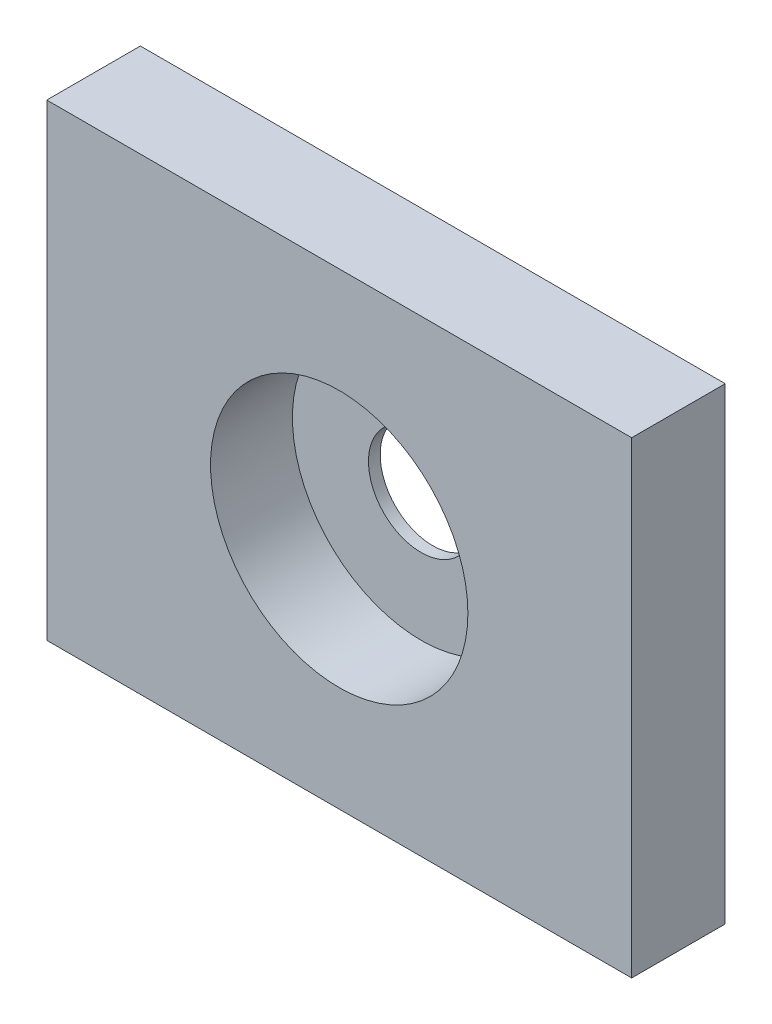
from build123d import *

# Parameters (mm, degrees)
ESQUISSE1_W             = 50
ESQUISSE1_H             = 40
ESQUISSE1_R             = 4.5
BOSS_EXTRU_1_DEPTH      = 8
ESQUISSE2_R             = 11
ENL_V_MAT_EXTRU_1_DEPTH = 7


with BuildPart() as part:
    # Esquisse1 → Boss.-Extru.1 (new body)
    with BuildSketch(Plane.XY):
        with Locations((25, 20)):
            Rectangle(ESQUISSE1_W, ESQUISSE1_H)
        with Locations((25, 20)):
            Circle(ESQUISSE1_R, mode=Mode.SUBTRACT)
    extrude(amount=BOSS_EXTRU_1_DEPTH)

    # Esquisse2 → Enlèv. mat.-Extru.1 (cut)
    with BuildSketch(Plane.XY.offset(8)):
        with Locations((25, 20)):
            Circle(ESQUISSE2_R)
    extrude(amount=-ENL_V_MAT_EXTRU_1_DEPTH, mode=Mode.SUBTRACT)


solid = part.part
